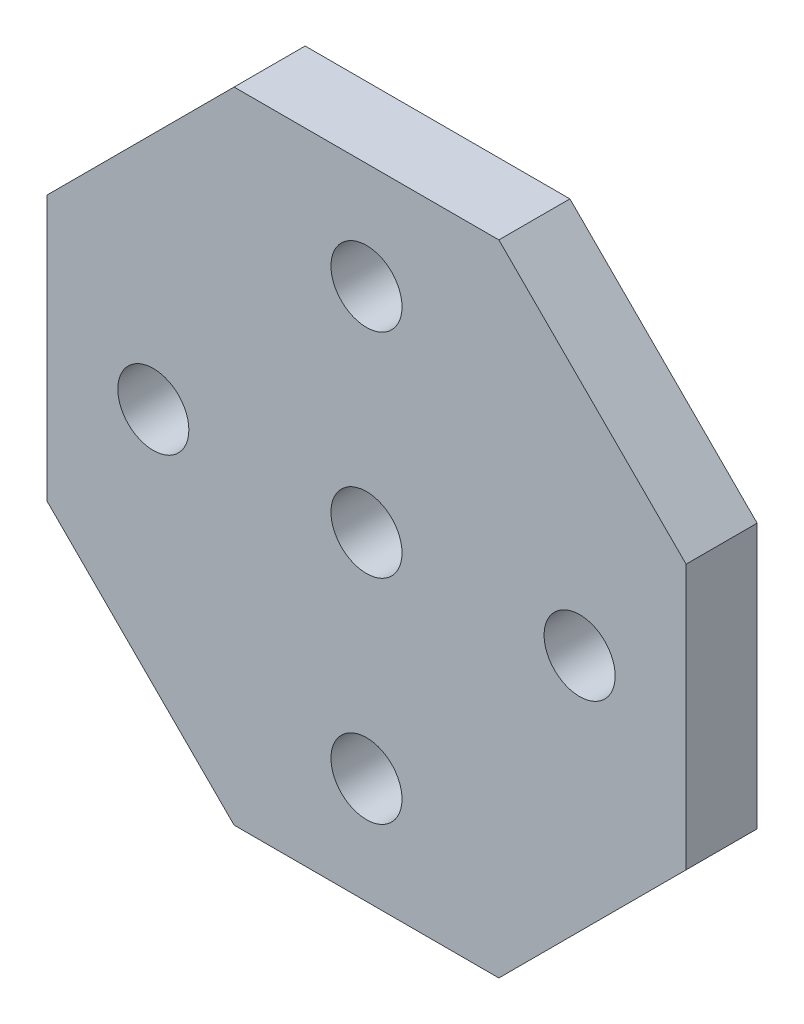
from build123d import *

# Parameters (mm, degrees)
MODEL_R                 = 1.5
SALIENTE_EXTRUIR1_DEPTH = 3


with BuildPart() as part:
    # Model → Saliente-Extruir1 (new body)
    with BuildSketch(Plane.XY):
        Polygon((221.337619938, 228.457019993), (210.157995889, 228.457019993), (202.252807913, 236.362207969), (202.252807913, 247.541832017), (210.157995889, 255.447019993), (221.337619938, 255.447019993), (229.242807914, 247.541832017), (229.242807914, 236.362207969), align=None)
        with Locations((215.747807914, 241.952019993)):
            Circle(MODEL_R, mode=Mode.SUBTRACT)
        with Locations((215.747807914, 232.952019993)):
            Circle(MODEL_R, mode=Mode.SUBTRACT)
        with Locations((215.747807914, 250.952019993)):
            Circle(MODEL_R, mode=Mode.SUBTRACT)
        with Locations((224.747807913, 241.952019993)):
            Circle(MODEL_R, mode=Mode.SUBTRACT)
        with Locations((206.747807913, 241.952019993)):
            Circle(MODEL_R, mode=Mode.SUBTRACT)
    extrude(amount=SALIENTE_EXTRUIR1_DEPTH)


solid = part.part
